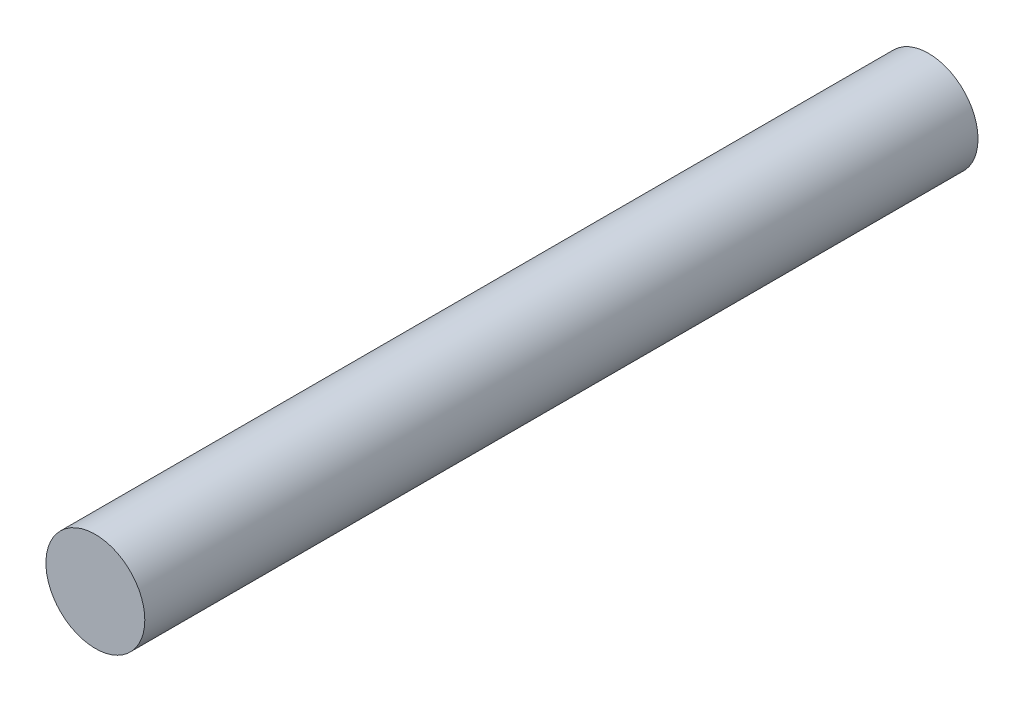
from build123d import *

# Parameters (mm, degrees)
SKETCH2_R           = 2
BOSS_EXTRUDE1_DEPTH = 33.7


with BuildPart() as part:
    # Sketch2 → Boss-Extrude1 (new body)
    with BuildSketch(Plane.XY):
        Circle(SKETCH2_R)
    extrude(amount=BOSS_EXTRUDE1_DEPTH)


solid = part.part
